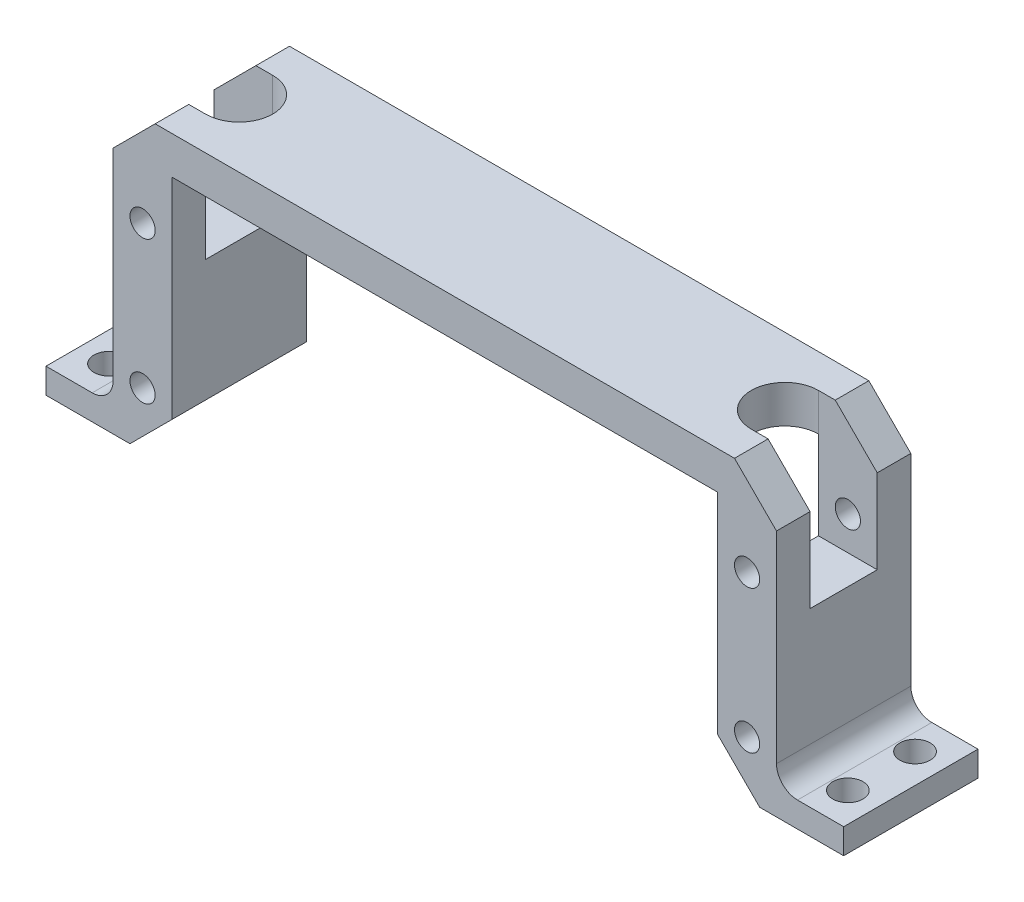
from build123d import *

# Parameters (mm, degrees)
BOSS_EXTRUDE1_DEPTH = 8
CHAMFER5_SIZE       = 5
FILLET1_R           = 2.5
SKETCH2_R           = 1.5
CUT_EXTRUDE1_DEPTH  = 61.848171706
SKETCH3_R           = 1.8
CUT_EXTRUDE2_DEPTH  = 58.554322166
SKETCH5_W           = 7
SKETCH5_H           = 8
CUT_EXTRUDE3_DEPTH  = 15
CUT_EXTRUDE5_DEPTH  = 15


with BuildPart() as part:
    # Sketch1 → Boss-Extrude1 (new, symmetric)
    with BuildSketch(Plane.XY):
        Polygon((-47.5, 0), (-32.5, 0), (-32.5, 30), (32.5, 30), (32.5, 0), (47.5, 0), (47.5, 3), (39.5, 3), (39.5, 34.5), (-39.5, 34.5), (-39.5, 3), (-47.5, 3), align=None)
    extrude(amount=BOSS_EXTRUDE1_DEPTH, both=True)

    # Chamfer5
    chamfer5_edges = [part.edges().sort_by_distance(p)[0] for p in [
        (-39.5, 34.5, 0),
        (39.5, 34.5, 0),
        (32.5, 0, 0),
        (-32.5, 0, 0),
    ]]
    chamfer(chamfer5_edges, length=CHAMFER5_SIZE)

    # Fillet1
    fillet1_edges = [part.edges().sort_by_distance(p)[0] for p in [
        (-39.5, 3, 0),
        (39.5, 3, 0),
    ]]
    fillet(fillet1_edges, radius=FILLET1_R)

    # Sketch2 → Cut-Extrude1 (cut, through all)
    with BuildSketch(Plane.XY.offset(8)):
        with Locations((36, 23.5)):
            Circle(SKETCH2_R)
        with Locations((36, 6.5)):
            Circle(SKETCH2_R)
    cut_extrude1 = extrude(amount=-CUT_EXTRUDE1_DEPTH, mode=Mode.SUBTRACT)

    # Mirror1: Cut-Extrude1 across plane
    add(cut_extrude1.mirror(Plane(origin=(0, 0, 0), x_dir=(0, 0, 1), z_dir=(1, 0, 0))), mode=Mode.SUBTRACT)

    # Sketch3 → Cut-Extrude2 (cut, through all)
    with BuildSketch(Plane(origin=(0, 3, 0), x_dir=(1, 0, 0), z_dir=(0, 1, 0))):
        with Locations(Location((44, 4, 0), (0, 0, 270))):
            Circle(SKETCH3_R)
        with Locations(Location((44, -4, 0), (0, 0, 270))):
            Circle(SKETCH3_R)
        with Locations(Location((-44, 4, 0), (0, 0, 270))):
            Circle(SKETCH3_R)
        with Locations(Location((-44, -4, 0), (0, 0, 270))):
            Circle(SKETCH3_R)
    extrude(amount=-CUT_EXTRUDE2_DEPTH, mode=Mode.SUBTRACT)

    # Sketch5 → Cut-Extrude3 (cut)
    with BuildSketch(Plane(origin=(0, 34.5, 0), x_dir=(1, 0, 0), z_dir=(0, 1, 0))):
        with Locations((36, 0)):
            Rectangle(SKETCH5_W, SKETCH5_H)
        with Locations((-36, 0)):
            Rectangle(SKETCH5_W, SKETCH5_H)
    extrude(amount=-CUT_EXTRUDE3_DEPTH, mode=Mode.SUBTRACT)

    # Sketch7 → Cut-Extrude5 (cut)
    with BuildSketch(Plane(origin=(0, 34.5, 0), x_dir=(1, 0, 0), z_dir=(0, 1, 0))):
        with BuildLine():
            Line((32.5, 4), (32.5, -4))
            ThreePointArc((32.5, -4), (28.5, 0), (32.5, 4))
        make_face()
        with BuildLine():
            Line((-32.5, 4), (-32.5, -4))
            ThreePointArc((-32.5, -4), (-28.5, 0), (-32.5, 4))
        make_face()
    extrude(amount=-CUT_EXTRUDE5_DEPTH, mode=Mode.SUBTRACT)


solid = part.part
